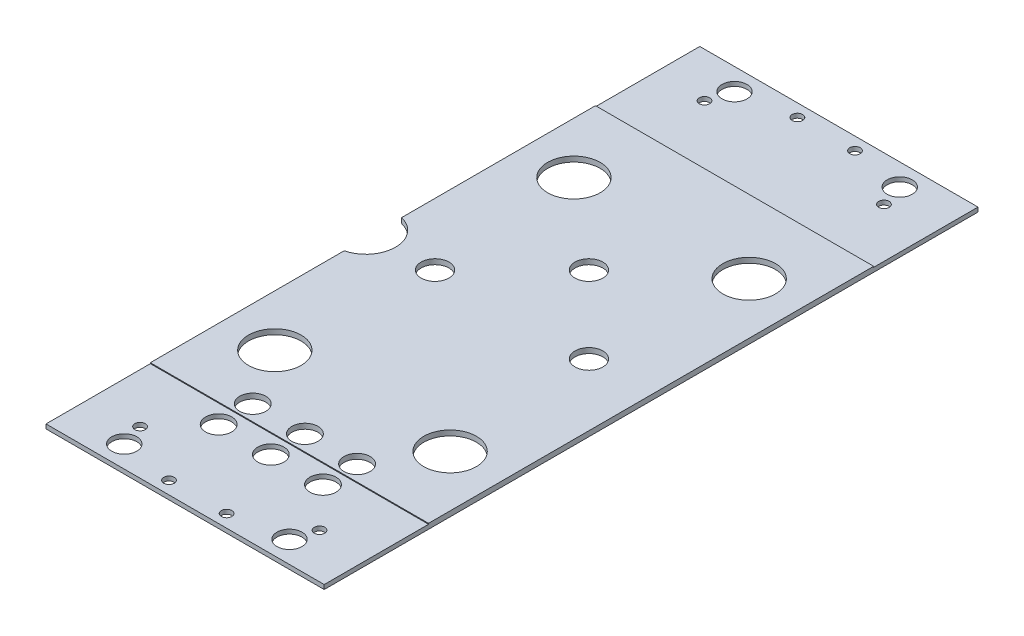
from build123d import *

# Parameters (mm, degrees)
CROQUIS2_W                 = 80
CROQUIS2_H                 = 128
SALIENTE_EXTRUIR1_DEPTH    = 1.5
CROQUIS1_W                 = 80
CROQUIS1_H                 = 30
SALIENTE_EXTRUIR2_DEPTH    = 1.25
CROQUIS6_R                 = 3.75
CORTAR_EXTRUIR1_DEPTH      = 5.25
CORTAR_EXTRUIR2_DEPTH      = 10
CORTAR_EXTRUIR2_DEPTH_BACK = 10
CROQUIS8_R                 = 3.75
CROQUIS10_R                = 7.565
CROQUIS10_R_2              = 1.5
CROQUIS10_R_3              = 3.6
CROQUIS10_R_4              = 4
CROQUIS10_R_5              = 8.5
CORTAR_EXTRUIR4_DEPTH      = 178.105194729


with BuildPart() as part:
    # Croquis2 → Saliente-Extruir1 (new body)
    with BuildSketch(Plane(origin=(0, 0, 0), x_dir=(1, 0, 0), z_dir=(0, 1, 0))):
        with Locations((40, 64)):
            Rectangle(CROQUIS2_W, CROQUIS2_H)
    extrude(amount=SALIENTE_EXTRUIR1_DEPTH)

    # Croquis1 → Saliente-Extruir2 (add)
    with BuildSketch(Plane.XZ):
        with Locations((40, 15)):
            Rectangle(CROQUIS1_W, CROQUIS1_H)
        with Locations((40, -143)):
            Rectangle(CROQUIS1_W, CROQUIS1_H)
    extrude(amount=-SALIENTE_EXTRUIR2_DEPTH)

    # Croquis6 → Cortar-Extruir1 (cut)
    with BuildSketch(Plane.XZ):
        with Locations(Location((24.95, 5.3, 0), (0, 0, 270))):
            Circle(CROQUIS6_R)
        with Locations(Location((54.95, 5.3, 0), (0, 0, 270))):
            Circle(CROQUIS6_R)
        with Locations(Location((39.95, 5.3, 0), (0, 0, 270))):
            Circle(CROQUIS6_R)
    extrude(amount=-CORTAR_EXTRUIR1_DEPTH, mode=Mode.SUBTRACT)

    # Croquis8 → Cortar-Extruir2 (cut, two sides: drawn at the far end of the back side and taken through both)
    with BuildSketch(Plane(origin=(0, 0, 0), x_dir=(1, 0, 0), z_dir=(0, 1, 0)).offset(-CORTAR_EXTRUIR2_DEPTH_BACK)):
        with Locations(Location((24.95, 4.5, 0), (0, 0, 90))):
            Circle(CROQUIS8_R)
        with Locations(Location((39.95, 4.5, 0), (0, 0, 90))):
            Circle(CROQUIS8_R)
        with Locations(Location((54.95, 4.5, 0), (0, 0, 90))):
            Circle(CROQUIS8_R)
    extrude(amount=CORTAR_EXTRUIR2_DEPTH + CORTAR_EXTRUIR2_DEPTH_BACK, mode=Mode.SUBTRACT)

    # Croquis10 → Cortar-Extruir4 (cut, through all)
    with BuildSketch(Plane(origin=(0, 0, 0), x_dir=(1, 0, 0), z_dir=(0, 1, 0))):
        with Locations(Location((65.2, 21, 0), (0, 0, 270))):
            Circle(CROQUIS10_R)
        with Locations(Location((14.8, 21, 0), (0, 0, 90))):
            Circle(CROQUIS10_R)
        with Locations(Location((65.8, -17.15, 0), (0, 0, 270))):
            Circle(CROQUIS10_R_2)
        with Locations(Location((63.75, -23.74, 0), (0, 0, 270))):
            Circle(CROQUIS10_R_3)
        with Locations(Location((48.28, -26.35, 0), (0, 0, 270))):
            Circle(CROQUIS10_R_2)
        with Locations(Location((31.72, -26.35, 0), (0, 0, 90))):
            Circle(CROQUIS10_R_2)
        with Locations(Location((16.25, -23.74, 0), (0, 0, 90))):
            Circle(CROQUIS10_R_3)
        with Locations(Location((14.2, -17.15, 0), (0, 0, 90))):
            Circle(CROQUIS10_R_2)
        with Locations(Location((17.87, 64, 0), (0, 0, 270))):
            Circle(CROQUIS10_R_4)
        with Locations(Location((40, 86.125, 0), (0, 0, 270))):
            Circle(CROQUIS10_R_4)
        with Locations(Location((62.13, 64, 0), (0, 0, 90))):
            Circle(CROQUIS10_R_4)
        with Locations(Location((65.8, 145.15, 0), (0, 0, 90))):
            Circle(CROQUIS10_R_2)
        with Locations(Location((63.75, 151.74, 0), (0, 0, 90))):
            Circle(CROQUIS10_R_3)
        with Locations(Location((48.28, 154.35, 0), (0, 0, 90))):
            Circle(CROQUIS10_R_2)
        with Locations(Location((14.2, 145.15, 0), (0, 0, 270))):
            Circle(CROQUIS10_R_2)
        with Locations(Location((31.72, 154.35, 0), (0, 0, 270))):
            Circle(CROQUIS10_R_2)
        with Locations(Location((16.25, 151.74, 0), (0, 0, 270))):
            Circle(CROQUIS10_R_3)
        with Locations(Location((65.2, 107, 0), (0, 0, 90))):
            Circle(CROQUIS10_R)
        with Locations(Location((14.8, 107, 0), (0, 0, 270))):
            Circle(CROQUIS10_R)
        with Locations((-2, 64)):
            Circle(CROQUIS10_R_5)
    extrude(amount=CORTAR_EXTRUIR4_DEPTH, mode=Mode.SUBTRACT)


solid = part.part
